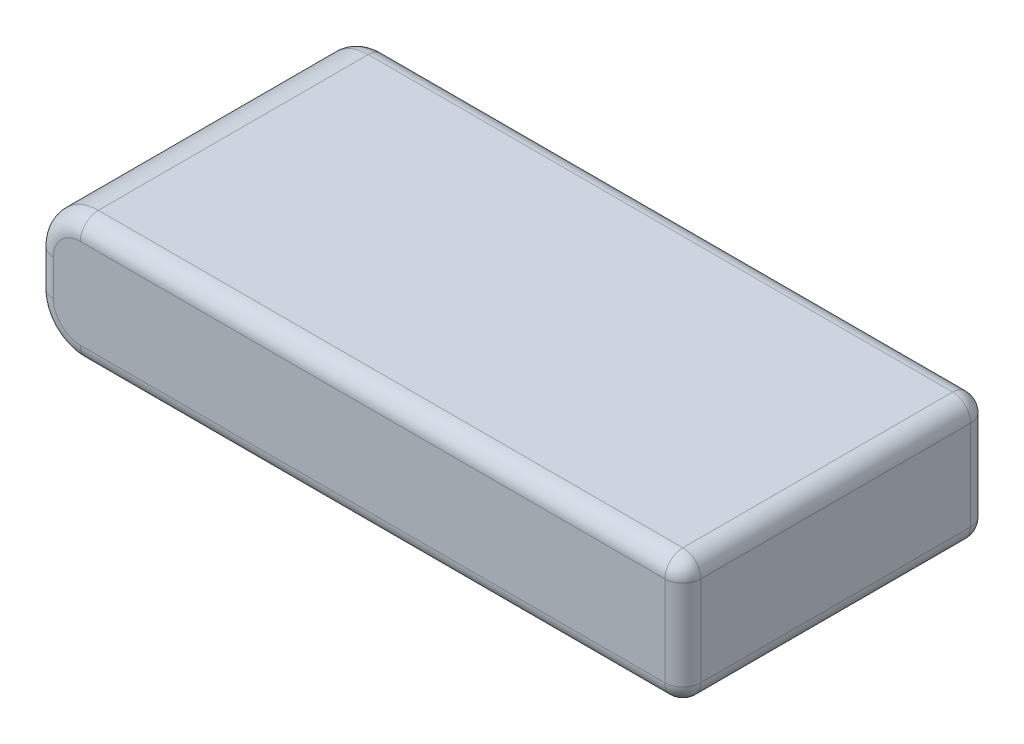
from build123d import *

# Parameters (mm, degrees)
SKETCH2_W           = 72
SKETCH2_H           = 34
BOSS_EXTRUDE1_DEPTH = 14
FILLET5_R           = 5
FILLET6_R           = 2


with BuildPart() as part:
    # Sketch2 → Boss-Extrude1 (new body)
    with BuildSketch(Plane(origin=(0, 0, 0), x_dir=(1, 0, 0), z_dir=(0, 1, 0))):
        Rectangle(SKETCH2_W, SKETCH2_H)
    extrude(amount=BOSS_EXTRUDE1_DEPTH)

    # Fillet5
    fillet5_edges = [part.edges().sort_by_distance(p)[0] for p in [
        (-36, 14, 0),
        (-36, 0, 0),
    ]]
    fillet(fillet5_edges, radius=FILLET5_R)

    # Fillet6
    fillet6_edges = [part.edges().sort_by_distance(p)[0] for p in [
        (-36, 7, 17),
        (-36, 7, -17),
        (2.5, 0, 17),
        (2.5, 14, 17),
        (-34.535533906, 12.535533906, 17),
        (-34.535533906, 1.464466094, 17),
        (-34.535533906, 12.535533906, -17),
        (-34.535533906, 1.464466094, -17),
        (36, 14, 0),
        (2.5, 0, -17),
        (36, 0, 0),
        (36, 7, 17),
        (36, 7, -17),
        (2.5, 14, -17),
    ]]
    fillet(fillet6_edges, radius=FILLET6_R)


solid = part.part
